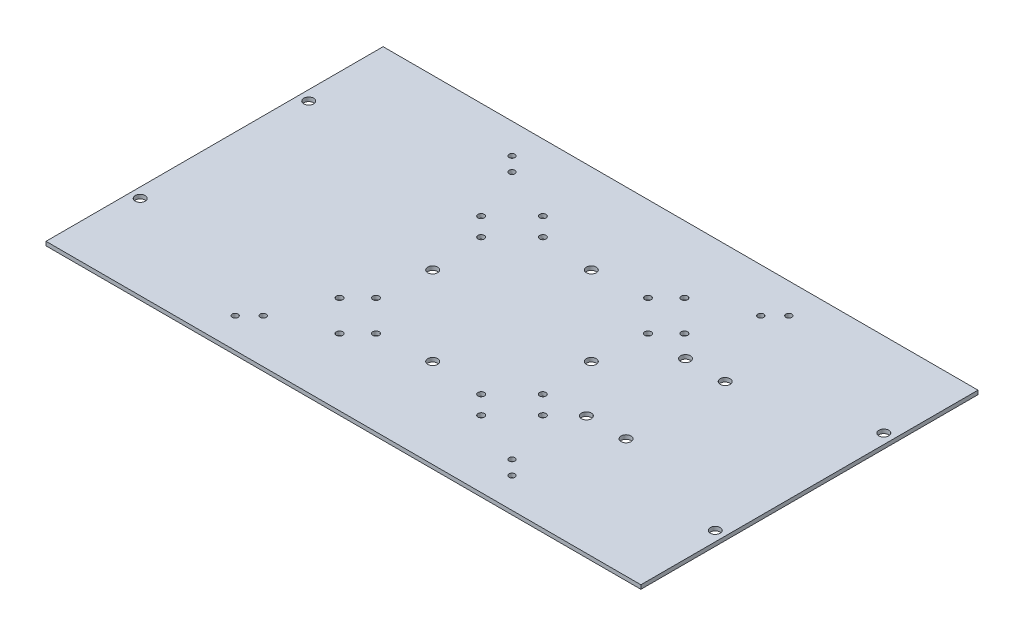
from build123d import *

# Parameters (mm, degrees)
SKETCH1_W           = 300
SKETCH1_H           = 170
BOSS_EXTRUDE3_DEPTH = 2
SKETCH3_R           = 2.5
CUT_EXTRUDE5_DEPTH  = 120
SKETCH4_R           = 2.5
CUT_EXTRUDE6_DEPTH  = 10
SKETCH5_R           = 1.6
CUT_EXTRUDE7_DEPTH  = 10
SKETCH6_R           = 2.5
CUT_EXTRUDE8_DEPTH  = 64
SKETCH8_R           = 1.5
CUT_EXTRUDE10_DEPTH = 10


with BuildPart() as part:
    # Sketch1 → Boss-Extrude3 (new body)
    with BuildSketch(Plane(origin=(0, 0, 0), x_dir=(1, 0, 0), z_dir=(0, 1, 0))):
        with Locations((15, 0)):
            Rectangle(SKETCH1_W, SKETCH1_H)
    extrude(amount=BOSS_EXTRUDE3_DEPTH)

    # Sketch3 → Cut-Extrude5 (cut)
    with BuildSketch(Plane(origin=(0, 2, 0), x_dir=(1, 0, 0), z_dir=(0, 1, 0))):
        with Locations(Location((15, 40, 0), (0, 0, 270))):
            Circle(SKETCH3_R)
        with Locations(Location((55, 0, 0), (0, 0, 270))):
            Circle(SKETCH3_R)
        with Locations(Location((15, -40, 0), (0, 0, 270))):
            Circle(SKETCH3_R)
        with Locations(Location((-25, 0, 0), (0, 0, 270))):
            Circle(SKETCH3_R)
    extrude(amount=-CUT_EXTRUDE5_DEPTH, mode=Mode.SUBTRACT)

    # Sketch4 → Cut-Extrude6 (cut)
    with BuildSketch(Plane(origin=(0, 2, 0), x_dir=(1, 0, 0), z_dir=(0, 1, 0))):
        with Locations(Location((97.5, -25, 0), (0, 0, 270))):
            Circle(SKETCH4_R)
        with Locations(Location((77.5, -25, 0), (0, 0, 270))):
            Circle(SKETCH4_R)
        with Locations(Location((97.5, 25, 0), (0, 0, 270))):
            Circle(SKETCH4_R)
        with Locations(Location((77.5, 25, 0), (0, 0, 270))):
            Circle(SKETCH4_R)
    extrude(amount=-CUT_EXTRUDE6_DEPTH, mode=Mode.SUBTRACT)

    # Sketch5 → Cut-Extrude7 (cut)
    with BuildSketch(Plane(origin=(0, 2, 0), x_dir=(1, 0, 0), z_dir=(0, 1, 0))):
        with Locations(Location((-11.516504294, -42.072853481, 0), (0, 0, 270))):
            Circle(SKETCH5_R)
        with Locations(Location((-20.70889245, -51.265241636, 0), (0, 0, 270))):
            Circle(SKETCH5_R)
        with Locations(Location((-36.265241636, -35.70889245, 0), (0, 0, 270))):
            Circle(SKETCH5_R)
        with Locations(Location((-27.072853481, -26.516504294, 0), (0, 0, 270))):
            Circle(SKETCH5_R)
        with Locations(Location((-27.072853481, 26.516504294, 0), (0, 0, 270))):
            Circle(SKETCH5_R)
        with Locations(Location((-36.265241636, 35.70889245, 0), (0, 0, 270))):
            Circle(SKETCH5_R)
        with Locations(Location((-11.516504294, 42.072853481, 0), (0, 0, 270))):
            Circle(SKETCH5_R)
        with Locations(Location((-20.70889245, 51.265241636, 0), (0, 0, 270))):
            Circle(SKETCH5_R)
        with Locations(Location((41.516504294, 42.072853481, 0), (0, 0, 270))):
            Circle(SKETCH5_R)
        with Locations(Location((50.70889245, 51.265241636, 0), (0, 0, 270))):
            Circle(SKETCH5_R)
        with Locations(Location((57.072853481, 26.516504294, 0), (0, 0, 270))):
            Circle(SKETCH5_R)
        with Locations(Location((66.265241636, 35.70889245, 0), (0, 0, 270))):
            Circle(SKETCH5_R)
        with Locations(Location((57.072853481, -26.516504294, 0), (0, 0, 270))):
            Circle(SKETCH5_R)
        with Locations(Location((66.265241636, -35.70889245, 0), (0, 0, 270))):
            Circle(SKETCH5_R)
        with Locations(Location((41.516504294, -42.072853481, 0), (0, 0, 270))):
            Circle(SKETCH5_R)
        with Locations(Location((50.70889245, -51.265241636, 0), (0, 0, 270))):
            Circle(SKETCH5_R)
    extrude(amount=-CUT_EXTRUDE7_DEPTH, mode=Mode.SUBTRACT)

    # Sketch6 → Cut-Extrude8 (cut)
    with BuildSketch(Plane(origin=(0, 2, 0), x_dir=(1, 0, 0), z_dir=(0, 1, 0))):
        with Locations(Location((-130, 42.5, 0), (0, 0, 270))):
            Circle(SKETCH6_R)
        with Locations(Location((-130, -42.5, 0), (0, 0, 270))):
            Circle(SKETCH6_R)
        with Locations(Location((160, 42.5, 0), (0, 0, 270))):
            Circle(SKETCH6_R)
        with Locations(Location((160, -42.5, 0), (0, 0, 270))):
            Circle(SKETCH6_R)
    extrude(amount=-CUT_EXTRUDE8_DEPTH, mode=Mode.SUBTRACT)

    # Sketch8 → Cut-Extrude10 (cut)
    with BuildSketch(Plane(origin=(0, 2, 0), x_dir=(1, 0, 0), z_dir=(0, 1, 0))):
        with Locations(Location((-47.734513627, 62.734513627, 0), (0, 0, 270))):
            Circle(SKETCH8_R)
        with Locations(Location((84.805581439, 69.805581439, 0), (0, 0, 270))):
            Circle(SKETCH8_R)
        with Locations(Location((77.734513627, 62.734513627, 0), (0, 0, 270))):
            Circle(SKETCH8_R)
        with Locations(Location((-54.805581439, 69.805581439, 0), (0, 0, 270))):
            Circle(SKETCH8_R)
        with Locations(Location((-54.805581439, -69.805581439, 0), (0, 0, 270))):
            Circle(SKETCH8_R)
        with Locations(Location((-47.734513627, -62.734513627, 0), (0, 0, 270))):
            Circle(SKETCH8_R)
        with Locations(Location((77.734513627, -62.734513627, 0), (0, 0, 270))):
            Circle(SKETCH8_R)
        with Locations(Location((84.805581439, -69.805581439, 0), (0, 0, 270))):
            Circle(SKETCH8_R)
    extrude(amount=-CUT_EXTRUDE10_DEPTH, mode=Mode.SUBTRACT)


solid = part.part
